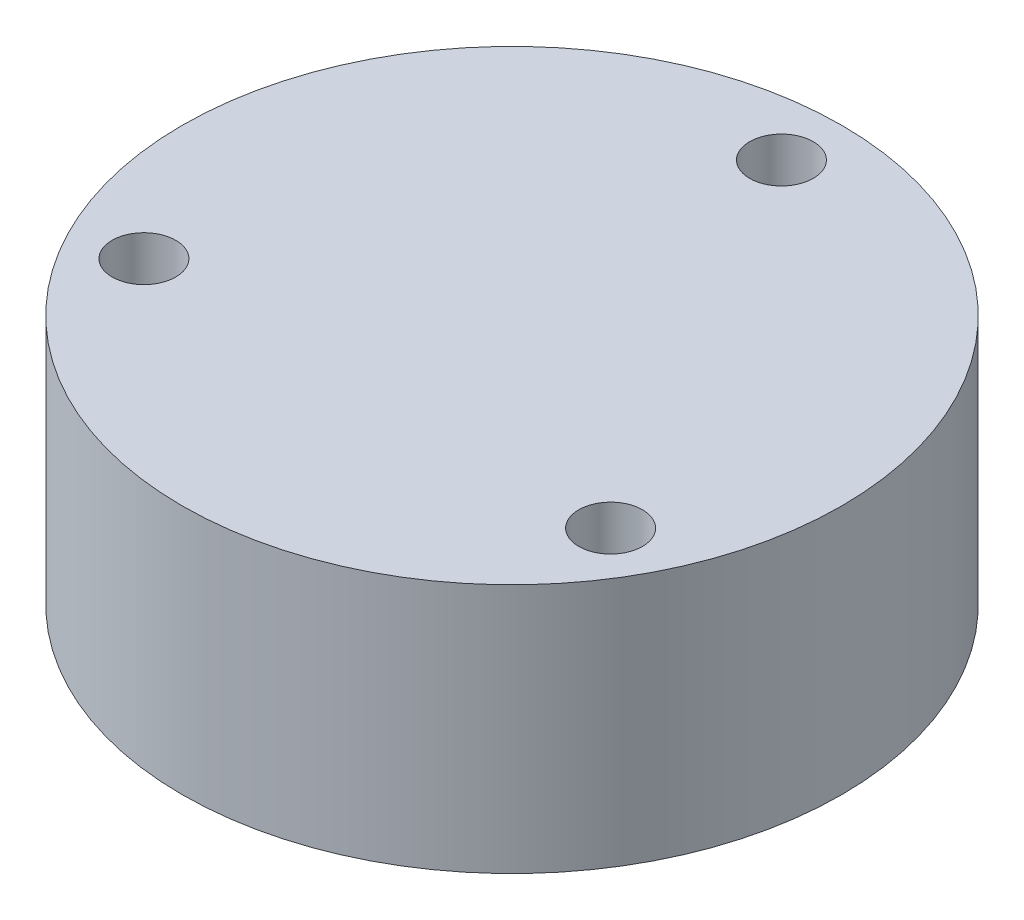
from build123d import *

# Parameters (mm, degrees)
SKETCH2_R           = 29
BOSS_EXTRUDE1_DEPTH = 22
SKETCH3_R           = 2.8
CUT_EXTRUDE1_DEPTH  = 47.540305113


with BuildPart() as part:
    # Sketch2 → Boss-Extrude1 (new body)
    with BuildSketch(Plane(origin=(0, 0, 0), x_dir=(1, 0, 0), z_dir=(0, 1, 0))):
        with Locations(Location((0, 0, 0), (0, 0, 270))):
            Circle(SKETCH2_R)
    extrude(amount=BOSS_EXTRUDE1_DEPTH)

    # Sketch3 → Cut-Extrude1 (cut, through all)
    with BuildSketch(Plane(origin=(0, 22, 0), x_dir=(1, 0, 0), z_dir=(0, 1, 0))):
        with Locations(Location((0, 23.7, 0), (0, 0, 270))):
            Circle(SKETCH3_R)
        with Locations(Location((20.52480207, -11.85, 0), (0, 0, 270))):
            Circle(SKETCH3_R)
        with Locations(Location((-20.52480207, -11.85, 0), (0, 0, 270))):
            Circle(SKETCH3_R)
    extrude(amount=-CUT_EXTRUDE1_DEPTH, mode=Mode.SUBTRACT)


solid = part.part
